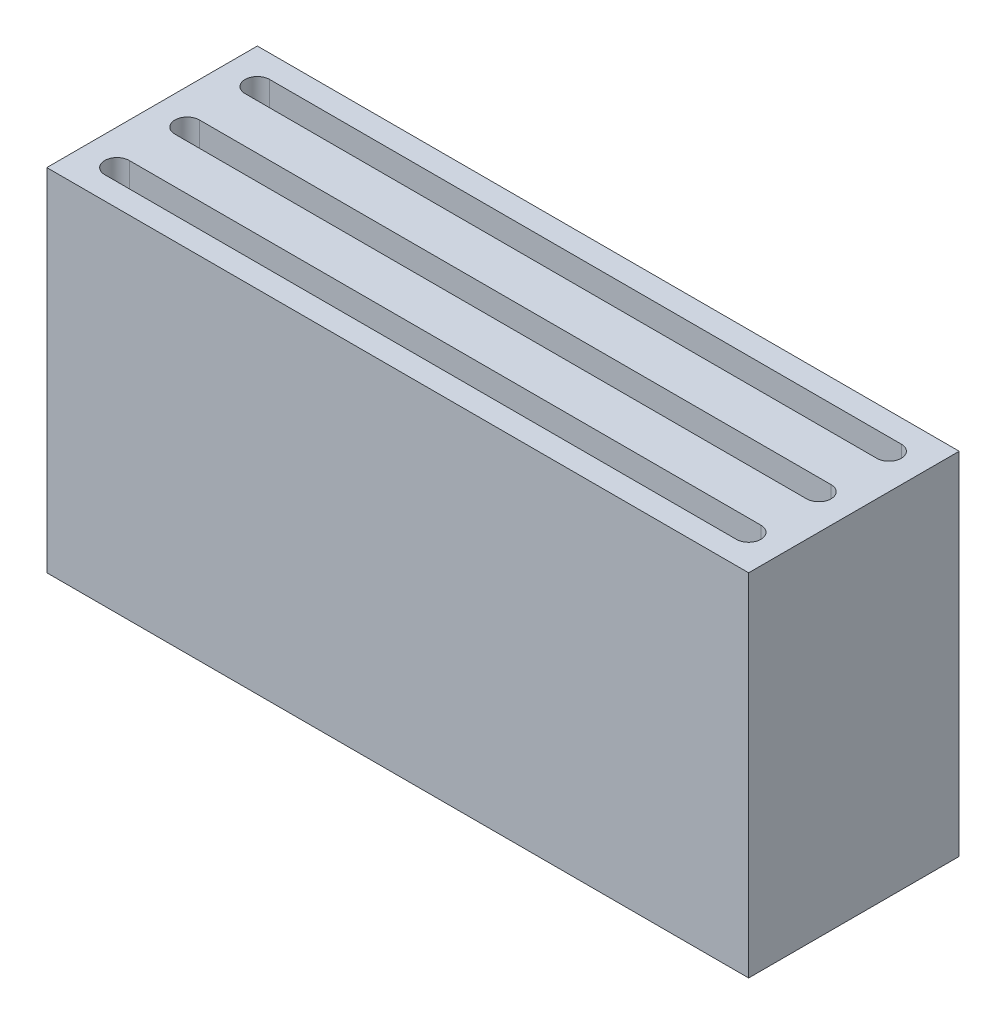
from build123d import *

# Parameters (mm, degrees)
SKETCH_1_W             = 100
SKETCH_1_H             = 30
EXTRUDE_1_DEPTH        = 50
CUT_EXTRUDE_1_DEPTH    = 50
PATTERN_LINEAR_1_COUNT = 3
PATTERN_LINEAR_1_PITCH = 10


with BuildPart() as part:
    # 草图1 → 凸台-拉伸1 (new body)
    with BuildSketch(Plane(origin=(0, 0, 0), x_dir=(1, 0, 0), z_dir=(0, 1, 0))):
        with Locations((50, 15)):
            Rectangle(SKETCH_1_W, SKETCH_1_H)
    extrude(amount=EXTRUDE_1_DEPTH)

    # 草图2 → 切除-拉伸1 (cut)
    with BuildSketch(Plane(origin=(0, 50, 0), x_dir=(1, 0, 0), z_dir=(0, 1, 0))):
        with BuildLine():
            Line((5, 6.75), (95, 6.75))
            ThreePointArc((95, 6.75), (96.75, 5), (95, 3.25))
            Line((95, 3.25), (5, 3.25))
            ThreePointArc((5, 3.25), (3.25, 5), (5, 6.75))
        make_face()
    cut_extrude_1 = extrude(amount=-CUT_EXTRUDE_1_DEPTH, mode=Mode.SUBTRACT)

    # 阵列(线性)1: 切除-拉伸1 ×3
    with Locations(*[(0, 0, -i * PATTERN_LINEAR_1_PITCH) for i in range(1, PATTERN_LINEAR_1_COUNT)]):
        add(cut_extrude_1, mode=Mode.SUBTRACT)


solid = part.part
